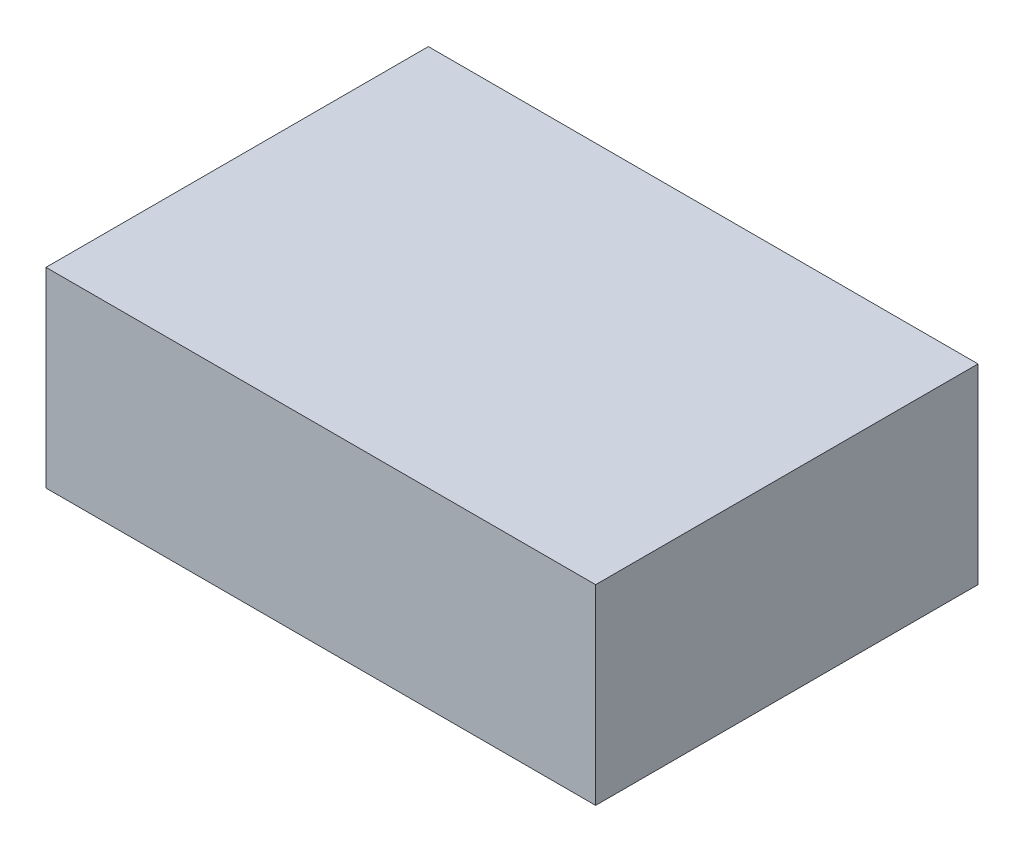
from build123d import *

# Parameters (mm, degrees)
SKETCH2_W           = 292.1
SKETCH2_H           = 203.2
BOSS_EXTRUDE1_DEPTH = 12.7
SKETCH3_W           = 292.1
SKETCH3_H           = 203.2
SKETCH3_W_2         = 266.7
SKETCH3_H_2         = 177.8
BOSS_EXTRUDE2_DEPTH = 88.9
CUT_EXTRUDE1_REACH  = 368.764
SKETCH4_W           = 152.4
SKETCH4_H           = 63.5


with BuildPart() as part:
    # Sketch2 → Boss-Extrude1 (new body)
    with BuildSketch(Plane(origin=(0, 0, 0), x_dir=(1, 0, 0), z_dir=(0, 1, 0))):
        with Locations((146.05, 101.6)):
            Rectangle(SKETCH2_W, SKETCH2_H)
    extrude(amount=BOSS_EXTRUDE1_DEPTH)

    # Sketch3 → Boss-Extrude2 (add)
    with BuildSketch(Plane.XZ):
        with Locations((146.05, -101.6)):
            Rectangle(SKETCH3_W, SKETCH3_H)
        with Locations((146.05, -101.6)):
            Rectangle(SKETCH3_W_2, SKETCH3_H_2, mode=Mode.SUBTRACT)
    extrude(amount=BOSS_EXTRUDE2_DEPTH)

    # Sketch4 → Cut-Extrude1 (cut, up to next)
    with BuildSketch(Plane.ZY, mode=Mode.PRIVATE) as cut_extrude1_sk1:
        with Locations((-101.6, -57.15)):
            Rectangle(SKETCH4_W, SKETCH4_H)
    cut_extrude1_tool1 = extrude(cut_extrude1_sk1.sketch, amount=-CUT_EXTRUDE1_REACH, mode=Mode.PRIVATE) & part.part
    add(cut_extrude1_tool1.solids().sort_by_distance((0, -57.15, -101.6))[0], mode=Mode.SUBTRACT)


solid = part.part
